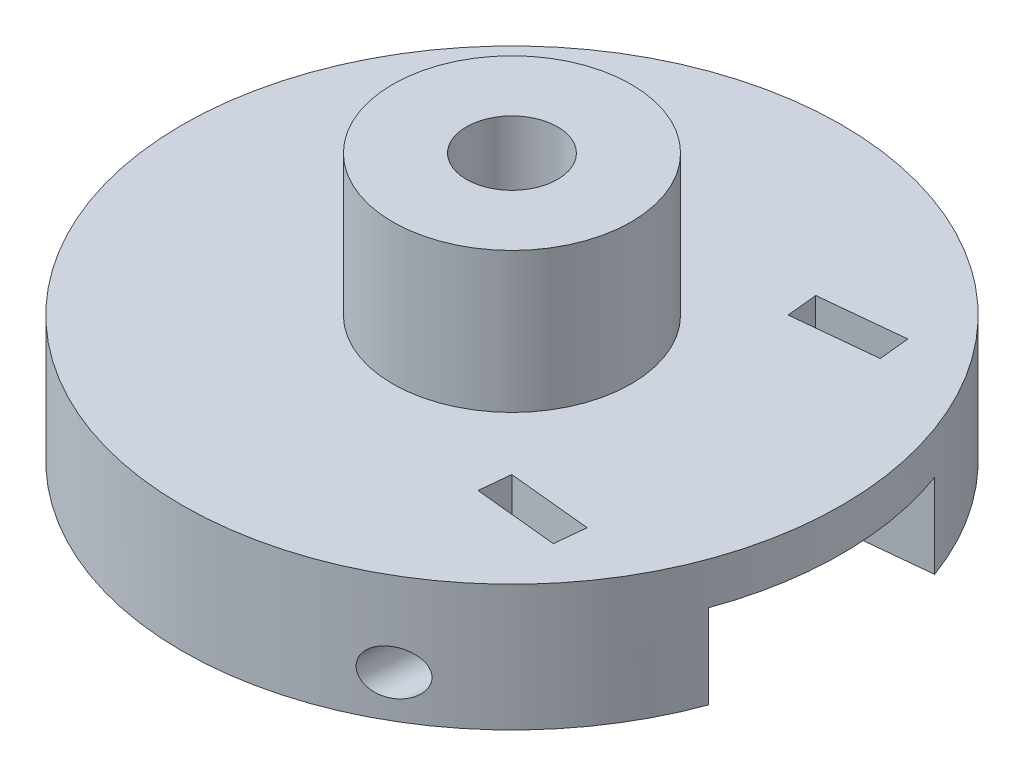
from build123d import *

# Parameters (mm, degrees)
SKETCH_1_R          = 23.5
EXTRUDE_1_DEPTH     = 3
CUT_EXTRUDE_1_DEPTH = 3
SKETCH_2_R          = 23.5
EXTRUDE_2_DEPTH     = 6
SKETCH_3_R          = 8.5
EXTRUDE_3_DEPTH     = 10
SKETCH_4_R          = 3.25
CUT_EXTRUDE_2_DEPTH = 19
CUT_EXTRUDE_4_DEPTH = 3
CUT_EXTRUDE_5_DEPTH = 39.281849485
SKETCH_8_R          = 1.6
CUT_EXTRUDE_6_DEPTH = 43.413034161


with BuildPart() as part:
    # Эскиз1 → Бобышка-Вытянуть1 (new body)
    with BuildSketch(Plane(origin=(0, 0, 0), x_dir=(1, 0, 0), z_dir=(0, 1, 0))):
        Circle(SKETCH_1_R)
    extrude(amount=EXTRUDE_1_DEPTH)

    # Эскиз1<4> → Вырез-Вытянуть1 (cut)
    with BuildSketch(Plane(origin=(0, 0, 0), x_dir=(1, 0, 0), z_dir=(0, 1, 0))):
        with BuildLine():
            Line((22.075284758, 8.058027232), (-15.70895781, 4.279602975))
            ThreePointArc((-15.70895781, 4.279602975), (-17.05705032, 3.599136049), (-17.6, 2.190024876))
            Line((-17.6, 2.190024876), (-17.6, -2.190024876))
            ThreePointArc((-17.6, -2.190024876), (-17.05705032, -3.599136049), (-15.70895781, -4.279602975))
            Line((-15.70895781, -4.279602975), (22.075284758, -8.058027232))
            ThreePointArc((22.075284758, -8.058027232), (23.5, 0), (22.075284758, 8.058027232))
        make_face()
    extrude(amount=CUT_EXTRUDE_1_DEPTH, mode=Mode.SUBTRACT)

    # Эскиз2 → Бобышка-Вытянуть2 (add)
    with BuildSketch(Plane(origin=(0, 3, 0), x_dir=(1, 0, 0), z_dir=(0, 1, 0))):
        Circle(SKETCH_2_R)
    extrude(amount=EXTRUDE_2_DEPTH)

    # Эскиз3 → Бобышка-Вытянуть3 (add)
    with BuildSketch(Plane(origin=(0, 9, 0), x_dir=(1, 0, 0), z_dir=(0, 1, 0))):
        Circle(SKETCH_3_R)
    extrude(amount=EXTRUDE_3_DEPTH)

    # Эскиз4 → Вырез-Вытянуть2 (cut)
    with BuildSketch(Plane(origin=(0, 19, 0), x_dir=(1, 0, 0), z_dir=(0, 1, 0))):
        Circle(SKETCH_4_R)
    extrude(amount=-CUT_EXTRUDE_2_DEPTH, mode=Mode.SUBTRACT)

    # Эскиз6 → Вырез-Вытянуть4 (cut)
    with BuildSketch(Plane.XZ.offset(-3)):
        with BuildLine():
            Line((-15.70895781, -4.279602975), (22.075284758, -8.058027232))
            ThreePointArc((22.075284758, -8.058027232), (23.5, 0), (22.075284758, 8.058027232))
            Line((22.075284758, 8.058027232), (-15.70895781, 4.279602975))
            ThreePointArc((-15.70895781, 4.279602975), (-17.05705032, 3.599136049), (-17.6, 2.190024876))
            Line((-17.6, 2.190024876), (-17.6, -2.190024876))
            ThreePointArc((-17.6, -2.190024876), (-17.05705032, -3.599136049), (-15.70895781, -4.279602975))
        make_face()
    extrude(amount=-CUT_EXTRUDE_4_DEPTH, mode=Mode.SUBTRACT)

    # Эскиз7 → Вырез-Вытянуть5 (cut, through all)
    with BuildSketch(Plane.XZ):
        Polygon((9.836327318, 9.849094174), (15.806550459, 10.446116488), (15.587642277, 12.635198307), (9.617419136, 12.038175993), align=None)
        Polygon((9.617419136, -12.038175993), (9.836327318, -9.849094174), (15.806550459, -10.446116488), (15.587642277, -12.635198307), align=None)
    extrude(amount=-CUT_EXTRUDE_5_DEPTH, mode=Mode.SUBTRACT)

    # Эскиз8 → Вырез-Вытянуть6 (cut, through all)
    with BuildSketch(Plane(origin=(-0.579257303, 0, -5.792573026), x_dir=(0.9950371902099893, 0, -0.09950371902099871), z_dir=(0.09950371902099871, 0, 0.9950371902099893))):
        with Locations((13.767532996, 3)):
            Circle(SKETCH_8_R)
    cut_extrude_6 = extrude(amount=-CUT_EXTRUDE_6_DEPTH, mode=Mode.SUBTRACT)

    # Зеркальное отражение1: Вырез-Вытянуть6 across plane
    add(cut_extrude_6.mirror(Plane.XY), mode=Mode.SUBTRACT)


solid = part.part
